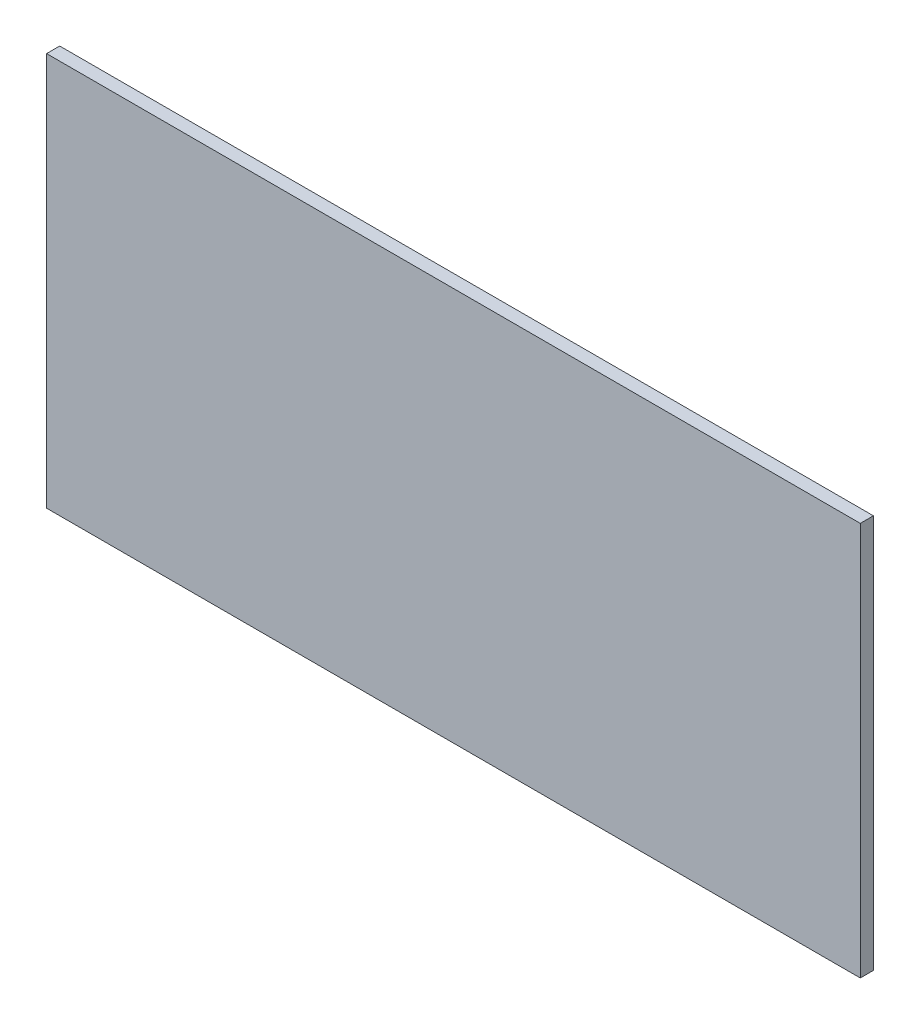
from build123d import *

# Parameters (mm, degrees)
SKETCH1_W           = 124
SKETCH1_H           = 60
BOSS_EXTRUDE1_DEPTH = 2


with BuildPart() as part:
    # Sketch1 → Boss-Extrude1 (new body)
    with BuildSketch(Plane.XY.offset(90)):
        with Locations((0, 30)):
            Rectangle(SKETCH1_W, SKETCH1_H)
    extrude(amount=BOSS_EXTRUDE1_DEPTH)


solid = part.part
